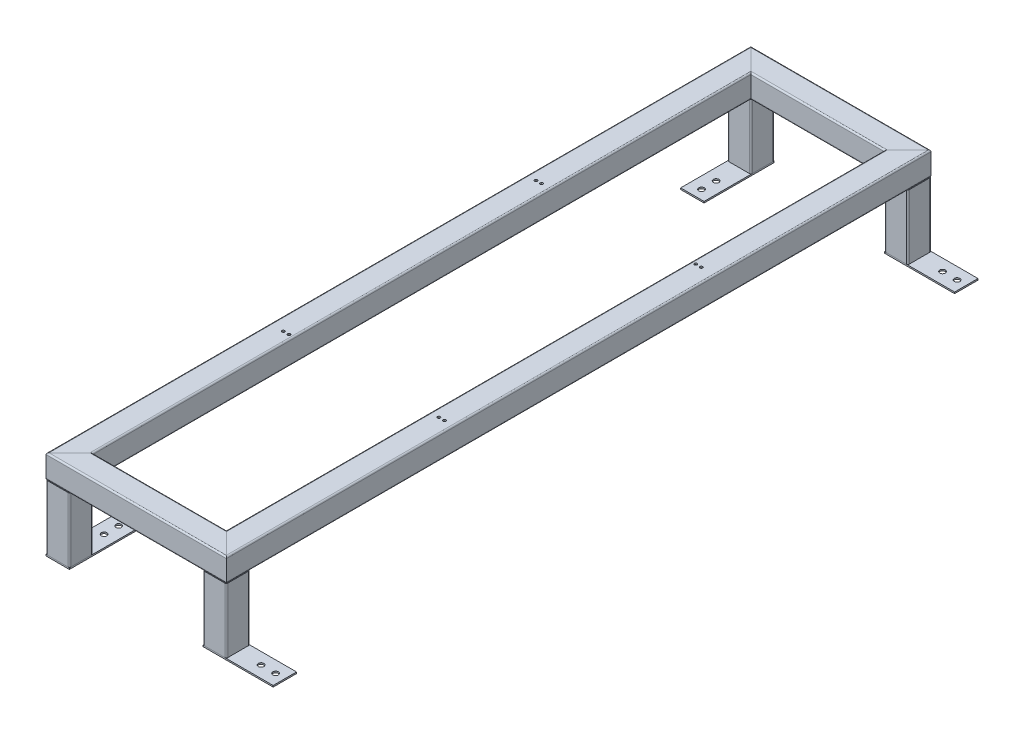
from build123d import *

# Parameters (mm, degrees)
TUBO_CUADRADA_1_X_1_1_DEPTH      = 181.921024484
TUBO_CUADRADA_1_X_1_1_DEPTH_BACK = 36.921024484
CROQUIS1_W                       = 22.225
CROQUIS1_H                       = 22.225
CROQUIS1_ON_SEGMENT_2_W          = 22.225
CROQUIS1_ON_SEGMENT_2_H          = 22.225
TUBO_CUADRADA_1_X_1_1_2_DEPTH    = 788.242048969
CROQUIS1_ON_SEGMENT_3_W          = 22.225
CROQUIS1_ON_SEGMENT_3_H          = 22.225
TUBO_CUADRADA_1_X_1_1_3_DEPTH    = 218.842048969
CROQUIS1_ON_SEGMENT_4_W          = 22.225
CROQUIS1_ON_SEGMENT_4_H          = 22.225
TUBO_CUADRADA_1_X_1_1_4_DEPTH    = 788.242048969
CROQUIS1_ON_SEGMENT_5_W          = 22.225
CROQUIS1_ON_SEGMENT_5_H          = 22.225
TUBO_CUADRADA_1_X_1_1_5_DEPTH    = 70
CROQUIS1_ON_SEGMENT_6_W          = 22.225
CROQUIS1_ON_SEGMENT_6_H          = 22.225
TUBO_CUADRADA_1_X_1_1_6_DEPTH    = 70
CROQUIS1_ON_SEGMENT_7_W          = 22.225
CROQUIS1_ON_SEGMENT_7_H          = 22.225
TUBO_CUADRADA_1_X_1_1_7_DEPTH    = 70
CROQUIS1_ON_SEGMENT_8_W          = 22.225
CROQUIS1_ON_SEGMENT_8_H          = 22.225
TUBO_CUADRADA_1_X_1_1_8_DEPTH    = 70
CROQUIS2_W                       = 25.4
CROQUIS2_H                       = 76.2
CROQUIS2_R                       = 3
SALIENTE_EXTRUIR1_DEPTH          = 1.5875
SALIENTE_EXTRUIR1_2_DEPTH        = 1.5875
CROQUIS2_W_2                     = 76.2
CROQUIS2_H_2                     = 25.4
SALIENTE_EXTRUIR1_3_DEPTH        = 1.5875
SALIENTE_EXTRUIR1_4_DEPTH        = 1.5875
CROQUIS4_R                       = 1.5
CORTAR_EXTRUIR1_DEPTH            = 776.472920324
CROQUIS5_R                       = 1.5
CORTAR_EXTRUIR2_DEPTH            = 30


with BuildPart() as part:
    # Croquis1 → Tubo cuadrada 1 X 1(1) (new, two sides: drawn at the far end of the back side and taken through both)
    with BuildSketch(Plane(origin=(0, 12.7, 727.1), x_dir=(0, 0, -1), z_dir=(1, 0, 0)).offset(-TUBO_CUADRADA_1_X_1_1_DEPTH_BACK)):
        with BuildLine():
            Line((11.1125, 12.7), (-11.1125, 12.7))
            ThreePointArc((-11.1125, 12.7), (-12.235032015, 12.235032015), (-12.7, 11.1125))
            Line((-12.7, 11.1125), (-12.7, -11.1125))
            ThreePointArc((-12.7, -11.1125), (-12.235032015, -12.235032015), (-11.1125, -12.7))
            Line((-11.1125, -12.7), (11.1125, -12.7))
            ThreePointArc((11.1125, -12.7), (12.235032015, -12.235032015), (12.7, -11.1125))
            Line((12.7, -11.1125), (12.7, 11.1125))
            ThreePointArc((12.7, 11.1125), (12.235032015, 12.235032015), (11.1125, 12.7))
        make_face()
        Rectangle(CROQUIS1_W, CROQUIS1_H, mode=Mode.SUBTRACT)
    extrude(amount=TUBO_CUADRADA_1_X_1_1_DEPTH + TUBO_CUADRADA_1_X_1_1_DEPTH_BACK)

    # Tubo cuadrada 1 X 1(1) mitre 1
    split(bisect_by=Plane(origin=(0, 0, 714.4), x_dir=(0, 1, 0), z_dir=(0.707106781, 0, 0.707106781)), keep=Keep.TOP)

    # Tubo cuadrada 1 X 1(1) mitre 2
    split(bisect_by=Plane(origin=(145, 0, 714.4), x_dir=(0, -1, 0), z_dir=(-0.707106781, 0, 0.707106781)), keep=Keep.TOP)


with BuildPart() as body_2:
    # Croquis1 on segment 2 (carried to segment 2) → Tubo cuadrada 1 X 1_1 2 (new body)
    with BuildSketch(Plane(origin=(157.7, 12.7, 751.321024484), x_dir=(-1, 0, 0), z_dir=(0, 0, -1))):
        with BuildLine():
            Line((11.1125, 12.7), (-11.1125, 12.7))
            ThreePointArc((-11.1125, 12.7), (-12.235032015, 12.235032015), (-12.7, 11.1125))
            Line((-12.7, 11.1125), (-12.7, -11.1125))
            ThreePointArc((-12.7, -11.1125), (-12.235032015, -12.235032015), (-11.1125, -12.7))
            Line((-11.1125, -12.7), (11.1125, -12.7))
            ThreePointArc((11.1125, -12.7), (12.235032015, -12.235032015), (12.7, -11.1125))
            Line((12.7, -11.1125), (12.7, 11.1125))
            ThreePointArc((12.7, 11.1125), (12.235032015, 12.235032015), (11.1125, 12.7))
        make_face()
        Rectangle(CROQUIS1_ON_SEGMENT_2_W, CROQUIS1_ON_SEGMENT_2_H, mode=Mode.SUBTRACT)
    extrude(amount=TUBO_CUADRADA_1_X_1_1_2_DEPTH)

    # Tubo cuadrada 1 X 1_1 2 mitre 1
    split(bisect_by=Plane(origin=(145, 0, 0), x_dir=(0, 1, 0), z_dir=(0.707106781, 0, 0.707106781)), keep=Keep.TOP)

    # Tubo cuadrada 1 X 1_1 2 mitre 2
    split(bisect_by=Plane(origin=(145, 0, 714.4), x_dir=(0, 1, 0), z_dir=(0.707106781, 0, -0.707106781)), keep=Keep.TOP)

    # Croquis4 → Cortar-Extruir1 (cut, through all)
    with BuildSketch(Plane.XZ):
        with Locations((-10.843419239, 209.625100017)):
            Circle(CROQUIS4_R)
        with Locations((-4.843419239, 209.625100017)):
            Circle(CROQUIS4_R)
        with Locations((-15.5, 493.130862631)):
            Circle(CROQUIS4_R)
        with Locations((-9.5, 493.130862631)):
            Circle(CROQUIS4_R)
        with Locations((160.5, 493.130862631)):
            Circle(CROQUIS4_R)
        with Locations((154.5, 493.130862631)):
            Circle(CROQUIS4_R)
        with Locations((149.843419239, 209.625100017)):
            Circle(CROQUIS4_R)
        with Locations((155.843419239, 209.625100017)):
            Circle(CROQUIS4_R)
    extrude(amount=-CORTAR_EXTRUIR1_DEPTH, mode=Mode.SUBTRACT)


with BuildPart() as body_3:
    # Croquis1 on segment 3 (carried to segment 3) → Tubo cuadrada 1 X 1_1 3 (new body)
    with BuildSketch(Plane(origin=(181.921024484, 12.7, -12.7), x_dir=(0, 0, 1), z_dir=(-1, 0, 0))):
        with BuildLine():
            Line((11.1125, 12.7), (-11.1125, 12.7))
            ThreePointArc((-11.1125, 12.7), (-12.235032015, 12.235032015), (-12.7, 11.1125))
            Line((-12.7, 11.1125), (-12.7, -11.1125))
            ThreePointArc((-12.7, -11.1125), (-12.235032015, -12.235032015), (-11.1125, -12.7))
            Line((-11.1125, -12.7), (11.1125, -12.7))
            ThreePointArc((11.1125, -12.7), (12.235032015, -12.235032015), (12.7, -11.1125))
            Line((12.7, -11.1125), (12.7, 11.1125))
            ThreePointArc((12.7, 11.1125), (12.235032015, 12.235032015), (11.1125, 12.7))
        make_face()
        Rectangle(CROQUIS1_ON_SEGMENT_3_W, CROQUIS1_ON_SEGMENT_3_H, mode=Mode.SUBTRACT)
    extrude(amount=TUBO_CUADRADA_1_X_1_1_3_DEPTH)

    # Tubo cuadrada 1 X 1_1 3 mitre 1
    split(bisect_by=Plane(origin=(0, 0, 0), x_dir=(0, 1, 0), z_dir=(0.707106781, 0, -0.707106781)), keep=Keep.TOP)

    # Tubo cuadrada 1 X 1_1 3 mitre 2
    split(bisect_by=Plane(origin=(145, 0, 0), x_dir=(0, -1, 0), z_dir=(-0.707106781, 0, -0.707106781)), keep=Keep.TOP)


with BuildPart() as body_4:
    # Croquis1 on segment 4 (carried to segment 4) → Tubo cuadrada 1 X 1_1 4 (new body)
    with BuildSketch(Plane(origin=(-12.7, 12.7, -36.921024484), x_dir=(1, 0, 0), z_dir=(0, 0, 1))):
        with BuildLine():
            Line((11.1125, 12.7), (-11.1125, 12.7))
            ThreePointArc((-11.1125, 12.7), (-12.235032015, 12.235032015), (-12.7, 11.1125))
            Line((-12.7, 11.1125), (-12.7, -11.1125))
            ThreePointArc((-12.7, -11.1125), (-12.235032015, -12.235032015), (-11.1125, -12.7))
            Line((-11.1125, -12.7), (11.1125, -12.7))
            ThreePointArc((11.1125, -12.7), (12.235032015, -12.235032015), (12.7, -11.1125))
            Line((12.7, -11.1125), (12.7, 11.1125))
            ThreePointArc((12.7, 11.1125), (12.235032015, 12.235032015), (11.1125, 12.7))
        make_face()
        Rectangle(CROQUIS1_ON_SEGMENT_4_W, CROQUIS1_ON_SEGMENT_4_H, mode=Mode.SUBTRACT)
    extrude(amount=TUBO_CUADRADA_1_X_1_1_4_DEPTH)

    # Tubo cuadrada 1 X 1_1 4 mitre 1
    split(bisect_by=Plane(origin=(0, 0, 0), x_dir=(0, -1, 0), z_dir=(-0.707106781, 0, 0.707106781)), keep=Keep.TOP)

    # Tubo cuadrada 1 X 1_1 4 mitre 2
    split(bisect_by=Plane(origin=(0, 0, 714.4), x_dir=(0, -1, 0), z_dir=(-0.707106781, 0, -0.707106781)), keep=Keep.TOP)

    # Croquis5 → Cortar-Extruir2 (cut)
    with BuildSketch(Plane(origin=(0, 25.4, 0), x_dir=(1, 0, 0), z_dir=(0, 1, 0))):
        with Locations(Location((-15.5, -217.7, 0), (0, 0, 180))):
            Circle(CROQUIS5_R)
        with Locations(Location((-9.5, -217.7, 0), (0, 0, 180))):
            Circle(CROQUIS5_R)
        with Locations(Location((-10.843419239, -496.7, 0), (0, 0, 180))):
            Circle(CROQUIS5_R)
        with Locations(Location((-4.843419239, -496.7, 0), (0, 0, 180))):
            Circle(CROQUIS5_R)
    extrude(amount=-CORTAR_EXTRUIR2_DEPTH, mode=Mode.SUBTRACT)


with BuildPart() as body_5:
    # Croquis1 on segment 5 (carried to segment 5) → Tubo cuadrada 1 X 1_1 5 (new body)
    with BuildSketch(Plane(origin=(157.7, 0, 727.1), x_dir=(0, 0, -1), z_dir=(0, -1, 0))):
        with BuildLine():
            Line((11.1125, 12.7), (-11.1125, 12.7))
            ThreePointArc((-11.1125, 12.7), (-12.235032015, 12.235032015), (-12.7, 11.1125))
            Line((-12.7, 11.1125), (-12.7, -11.1125))
            ThreePointArc((-12.7, -11.1125), (-12.235032015, -12.235032015), (-11.1125, -12.7))
            Line((-11.1125, -12.7), (11.1125, -12.7))
            ThreePointArc((11.1125, -12.7), (12.235032015, -12.235032015), (12.7, -11.1125))
            Line((12.7, -11.1125), (12.7, 11.1125))
            ThreePointArc((12.7, 11.1125), (12.235032015, 12.235032015), (11.1125, 12.7))
        make_face()
        Rectangle(CROQUIS1_ON_SEGMENT_5_W, CROQUIS1_ON_SEGMENT_5_H, mode=Mode.SUBTRACT)
    extrude(amount=TUBO_CUADRADA_1_X_1_1_5_DEPTH)


with BuildPart() as body_6:
    # Croquis1 on segment 6 (carried to segment 6) → Tubo cuadrada 1 X 1_1 6 (new body)
    with BuildSketch(Plane(origin=(-12.7, 0, 727.1), x_dir=(0, 0, -1), z_dir=(0, -1, 0))):
        with BuildLine():
            Line((11.1125, 12.7), (-11.1125, 12.7))
            ThreePointArc((-11.1125, 12.7), (-12.235032015, 12.235032015), (-12.7, 11.1125))
            Line((-12.7, 11.1125), (-12.7, -11.1125))
            ThreePointArc((-12.7, -11.1125), (-12.235032015, -12.235032015), (-11.1125, -12.7))
            Line((-11.1125, -12.7), (11.1125, -12.7))
            ThreePointArc((11.1125, -12.7), (12.235032015, -12.235032015), (12.7, -11.1125))
            Line((12.7, -11.1125), (12.7, 11.1125))
            ThreePointArc((12.7, 11.1125), (12.235032015, 12.235032015), (11.1125, 12.7))
        make_face()
        Rectangle(CROQUIS1_ON_SEGMENT_6_W, CROQUIS1_ON_SEGMENT_6_H, mode=Mode.SUBTRACT)
    extrude(amount=TUBO_CUADRADA_1_X_1_1_6_DEPTH)


with BuildPart() as body_7:
    # Croquis1 on segment 7 (carried to segment 7) → Tubo cuadrada 1 X 1_1 7 (new body)
    with BuildSketch(Plane(origin=(-12.7, 0, -12.7), x_dir=(0, 0, -1), z_dir=(0, -1, 0))):
        with BuildLine():
            Line((11.1125, 12.7), (-11.1125, 12.7))
            ThreePointArc((-11.1125, 12.7), (-12.235032015, 12.235032015), (-12.7, 11.1125))
            Line((-12.7, 11.1125), (-12.7, -11.1125))
            ThreePointArc((-12.7, -11.1125), (-12.235032015, -12.235032015), (-11.1125, -12.7))
            Line((-11.1125, -12.7), (11.1125, -12.7))
            ThreePointArc((11.1125, -12.7), (12.235032015, -12.235032015), (12.7, -11.1125))
            Line((12.7, -11.1125), (12.7, 11.1125))
            ThreePointArc((12.7, 11.1125), (12.235032015, 12.235032015), (11.1125, 12.7))
        make_face()
        Rectangle(CROQUIS1_ON_SEGMENT_7_W, CROQUIS1_ON_SEGMENT_7_H, mode=Mode.SUBTRACT)
    extrude(amount=TUBO_CUADRADA_1_X_1_1_7_DEPTH)


with BuildPart() as body_8:
    # Croquis1 on segment 8 (carried to segment 8) → Tubo cuadrada 1 X 1_1 8 (new body)
    with BuildSketch(Plane(origin=(157.7, 0, -12.7), x_dir=(0, 0, -1), z_dir=(0, -1, 0))):
        with BuildLine():
            Line((11.1125, 12.7), (-11.1125, 12.7))
            ThreePointArc((-11.1125, 12.7), (-12.235032015, 12.235032015), (-12.7, 11.1125))
            Line((-12.7, 11.1125), (-12.7, -11.1125))
            ThreePointArc((-12.7, -11.1125), (-12.235032015, -12.235032015), (-11.1125, -12.7))
            Line((-11.1125, -12.7), (11.1125, -12.7))
            ThreePointArc((11.1125, -12.7), (12.235032015, -12.235032015), (12.7, -11.1125))
            Line((12.7, -11.1125), (12.7, 11.1125))
            ThreePointArc((12.7, 11.1125), (12.235032015, 12.235032015), (11.1125, 12.7))
        make_face()
        Rectangle(CROQUIS1_ON_SEGMENT_8_W, CROQUIS1_ON_SEGMENT_8_H, mode=Mode.SUBTRACT)
    extrude(amount=TUBO_CUADRADA_1_X_1_1_8_DEPTH)


with BuildPart() as body_9:
    # Croquis2 → Saliente-Extruir1 (new body)
    with BuildSketch(Plane.XZ.offset(70)):
        with Locations((-12.7, 701.7)):
            Rectangle(CROQUIS2_W, CROQUIS2_H)
        with Locations(Location((-12.7, 673.6, 0), (0, 0, 270))):
            Circle(CROQUIS2_R, mode=Mode.SUBTRACT)
        with Locations(Location((-12.7, 689.4, 0), (0, 0, 270))):
            Circle(CROQUIS2_R, mode=Mode.SUBTRACT)
    extrude(amount=SALIENTE_EXTRUIR1_DEPTH)


with BuildPart() as body_10:
    # Croquis2 → Saliente-Extruir1 2 (new body)
    with BuildSketch(Plane.XZ.offset(70)):
        with Locations((-12.7, 12.7)):
            Rectangle(CROQUIS2_W, CROQUIS2_H)
        with Locations(Location((-12.7, 25, 0), (0, 0, 90))):
            Circle(CROQUIS2_R, mode=Mode.SUBTRACT)
        with Locations(Location((-12.7, 40.8, 0), (0, 0, 90))):
            Circle(CROQUIS2_R, mode=Mode.SUBTRACT)
    extrude(amount=SALIENTE_EXTRUIR1_2_DEPTH)


with BuildPart() as body_11:
    # Croquis2 → Saliente-Extruir1 3 (new body)
    with BuildSketch(Plane.XZ.offset(70)):
        with Locations((183.1, 727.1)):
            Rectangle(CROQUIS2_W_2, CROQUIS2_H_2)
        with Locations(Location((195.4, 727.1, 0), (0, 0, 270))):
            Circle(CROQUIS2_R, mode=Mode.SUBTRACT)
        with Locations(Location((211.2, 727.1, 0), (0, 0, 270))):
            Circle(CROQUIS2_R, mode=Mode.SUBTRACT)
    extrude(amount=SALIENTE_EXTRUIR1_3_DEPTH)


with BuildPart() as body_12:
    # Croquis2 → Saliente-Extruir1 4 (new body)
    with BuildSketch(Plane.XZ.offset(70)):
        with Locations((183.1, -12.7)):
            Rectangle(CROQUIS2_W_2, CROQUIS2_H_2)
        with Locations(Location((211.2, -12.7, 0), (0, 0, 90))):
            Circle(CROQUIS2_R, mode=Mode.SUBTRACT)
        with Locations(Location((195.4, -12.7, 0), (0, 0, 90))):
            Circle(CROQUIS2_R, mode=Mode.SUBTRACT)
    extrude(amount=SALIENTE_EXTRUIR1_4_DEPTH)


solid = Compound([part.part, body_2.part, body_3.part, body_4.part, body_5.part, body_6.part, body_7.part, body_8.part, body_9.part, body_10.part, body_11.part, body_12.part])
